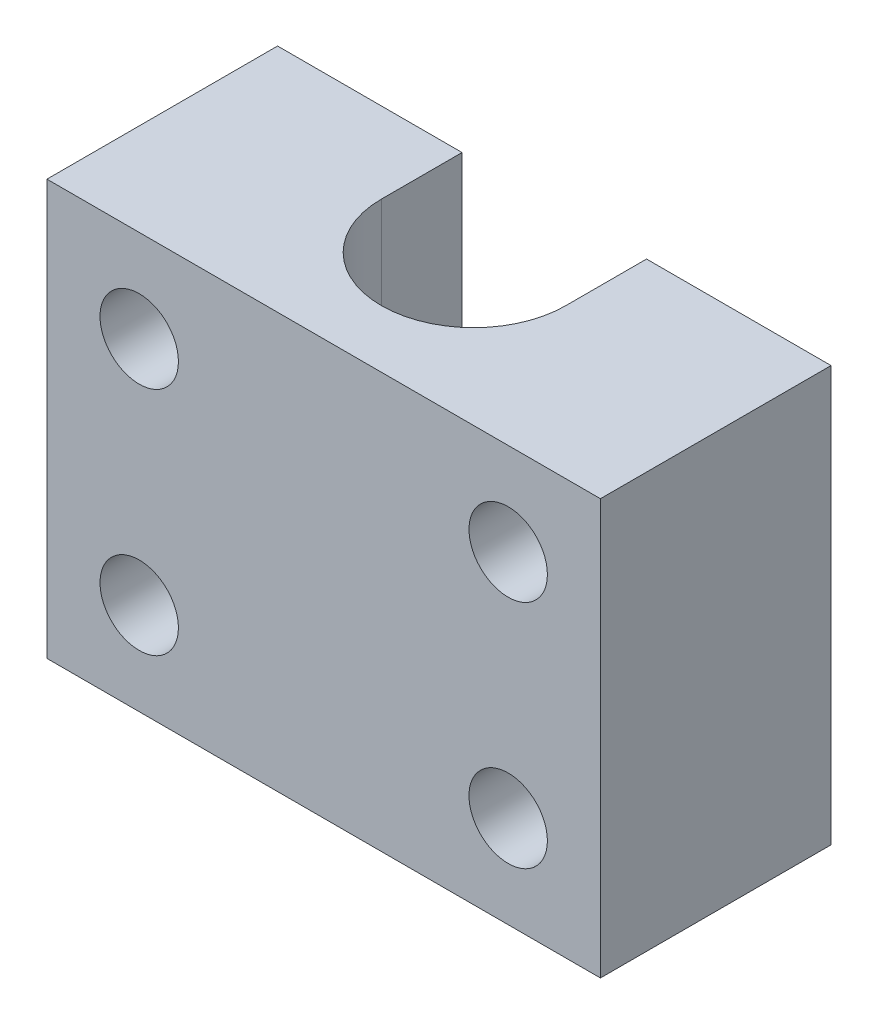
from build123d import *

# Parameters (mm, degrees)
SKETCH1_W           = 24
SKETCH1_H           = 18
BOSS_EXTRUDE1_DEPTH = 10
CUT_EXTRUDE1_DEPTH  = 23.588713996
HOLE1_D             = 3.4
HOLE2_D             = 3.4
HOLE3_D             = 3.4
HOLE4_D             = 3.4


with BuildPart() as part:
    # Sketch1 → Boss-Extrude1 (new body)
    with BuildSketch(Plane.XY.offset(6.5)):
        Rectangle(SKETCH1_W, SKETCH1_H)
    extrude(amount=-BOSS_EXTRUDE1_DEPTH)

    # Sketch2 → Cut-Extrude1 (cut, through all)
    with BuildSketch(Plane(origin=(0, 9, 0), x_dir=(-1, 0, 0), z_dir=(0, 1, 0))):
        with BuildLine():
            Line((-4, -3.5), (4, -3.5))
            Line((4, -3.5), (4, 0))
            ThreePointArc((4, 0), (0, 4), (-4, 0))
            Line((-4, 0), (-4, -3.5))
        make_face()
    extrude(amount=-CUT_EXTRUDE1_DEPTH, mode=Mode.SUBTRACT)

    # Hole1 (through all)
    with Locations(Plane.XY.offset(6.5)):
        with Locations((8, -5)):
            Hole(HOLE1_D / 2)

    # Hole2 (through all)
    with Locations(Plane.XY.offset(6.5)):
        with Locations((-8, 5)):
            Hole(HOLE2_D / 2)

    # Hole3 (through all)
    with Locations(Plane.XY.offset(6.5)):
        with Locations((-8, -5)):
            Hole(HOLE3_D / 2)

    # Hole4 (through all)
    with Locations(Plane.XY.offset(6.5)):
        with Locations((8, 5)):
            Hole(HOLE4_D / 2)


solid = part.part
